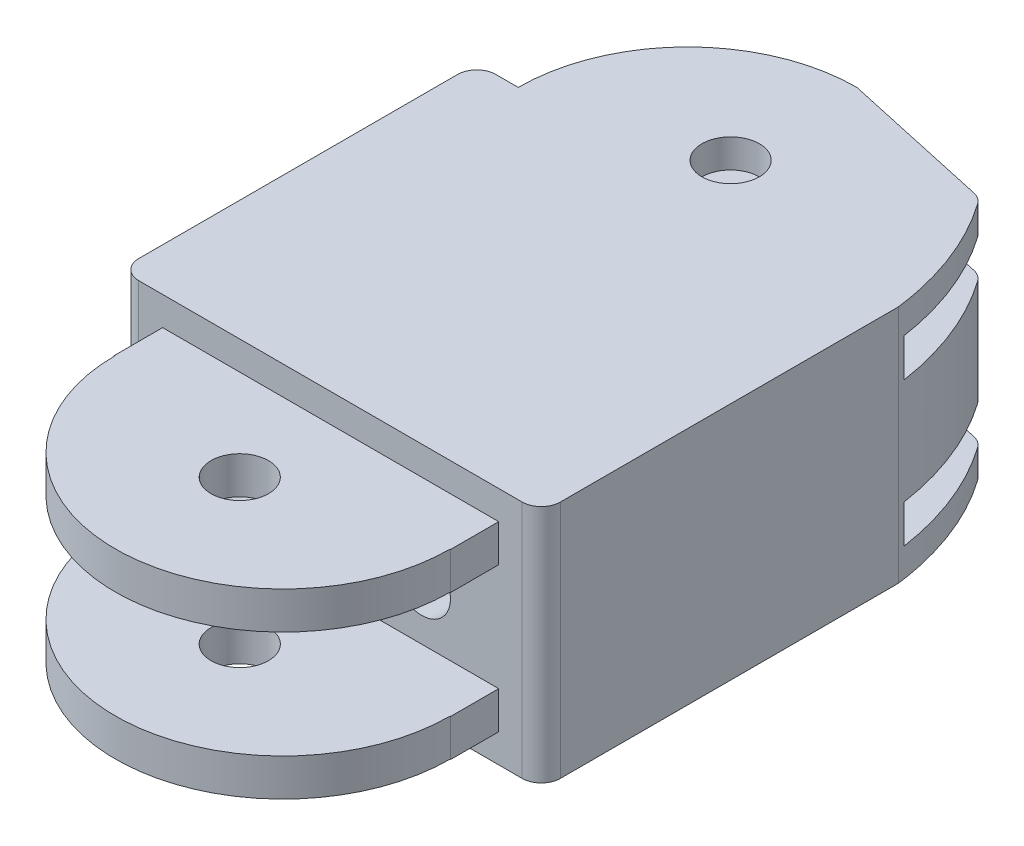
from build123d import *

# Parameters (mm, degrees)
SKETCH2_W             = 17.554431489
SKETCH2_H             = 1.95
BOSS_EXTRUDE1_DEPTH   = 8.75
BOSS_EXTRUDE1_2_DEPTH = 8.75
CUT_EXTRUDE1_DEPTH    = 26.518349076
SKETCH4_W             = 22.027215745
SKETCH4_H             = 12.505427167
BOSS_EXTRUDE2_DEPTH   = 30
SKETCH5_R             = 1.5
CUT_EXTRUDE2_DEPTH    = 12
SKETCH6_W             = 22.027215745
SKETCH6_H             = 12.505427167
SKETCH6_W_2           = 17.554431489
SKETCH6_H_2           = 1.95
CUT_EXTRUDE3_DEPTH    = 2.5
SKETCH7_R             = 1.5
CUT_EXTRUDE4_DEPTH    = 13
SKETCH8_R             = 1.5
CUT_EXTRUDE5_DEPTH    = 28
FILLET3_R             = 1
SKETCH9_W             = 22.02721574
SKETCH9_H             = 2
CUT_EXTRUDE6_DEPTH    = 11


with BuildPart() as part:
    # Sketch2 → Boss-Extrude1 (new body)
    with BuildSketch(Plane.XY):
        with Locations((-13.228930986, -27.845183414)):
            Rectangle(SKETCH2_W, SKETCH2_H)
    extrude(amount=BOSS_EXTRUDE1_DEPTH)


with BuildPart() as body_2:
    # Sketch2 → Boss-Extrude1 2 (new body)
    with BuildSketch(Plane.XY):
        with Locations((-13.228930986, -20.289756247)):
            Rectangle(SKETCH2_W, SKETCH2_H)
    extrude(amount=BOSS_EXTRUDE1_2_DEPTH)


with BuildPart() as cut_extrude1_tool:
    # Sketch3 → Cut-Extrude1 (new, through all)
    with BuildSketch(Plane(origin=(0, -19.314756247, 0), x_dir=(1, 0, 0), z_dir=(0, 1, 0))):
        with BuildLine():
            ThreePointArc((-13.228930986, -8.75), (-7.041746651, -6.187184335), (-4.478930986, 0))
            add(Edge.make_bspline(
                [(-4.478930986, 0), (1.138349918, -4.151657709), (-4.451715242, -8.75)],
                knots=[0, 0, 0, 1, 1, 1], degree=2))
            add(Edge.make_bspline(
                [(-22.006146731, -8.75), (-13.228930986, -12.473510392), (-4.451715242, -8.75)],
                knots=[0, 0, 0, 1, 1, 1], degree=2))
            add(Edge.make_bspline(
                [(-21.978930986, 0), (-25.926969228, -4.242865138), (-22.006146731, -8.75)],
                knots=[0, 0, 0, 1, 1, 1], degree=2))
            ThreePointArc((-21.978930986, 0), (-19.416115322, -6.187184335), (-13.228930986, -8.75))
        make_face()
    extrude(amount=-CUT_EXTRUDE1_DEPTH)


with BuildPart() as part_1:
    add(part.part)

    # Cut-Extrude1: cut by cut_extrude1_tool
    add(cut_extrude1_tool.part, mode=Mode.SUBTRACT)



with BuildPart() as body_2_1:
    add(body_2.part)

    # Cut-Extrude1: cut by cut_extrude1_tool
    add(cut_extrude1_tool.part, mode=Mode.SUBTRACT)


with BuildPart() as part_2:
    add(part_1.part)

    add(body_2_1.part)  # Boss-Extrude2 merges body 2
    # Sketch4 → Boss-Extrude2 (add)
    with BuildSketch(Plane(origin=(0, 0, 0), x_dir=(-1, 0, 0), z_dir=(0, 0, -1))):
        with Locations((13.242538859, -24.067469831)):
            Rectangle(SKETCH4_W, SKETCH4_H)
    extrude(amount=BOSS_EXTRUDE2_DEPTH)

    # Sketch5 → Cut-Extrude2 (cut)
    with BuildSketch(Plane(origin=(0, -19.314756247, 0), x_dir=(1, 0, 0), z_dir=(0, 1, 0))):
        with Locations(Location((-13.228930986, -2.25, 0), (0, 0, 270))):
            Circle(SKETCH5_R)
    extrude(amount=-CUT_EXTRUDE2_DEPTH, mode=Mode.SUBTRACT)

    # Sketch6 → Cut-Extrude3 (cut)
    with BuildSketch(Plane.XY):
        with Locations((-13.242538859, -24.067469831)):
            Rectangle(SKETCH6_W, SKETCH6_H)
        with Locations((-13.228930986, -27.845183414)):
            Rectangle(SKETCH6_W_2, SKETCH6_H_2, mode=Mode.SUBTRACT)
        with Locations((-13.228930986, -20.289756247)):
            Rectangle(SKETCH6_W_2, SKETCH6_H_2, mode=Mode.SUBTRACT)
    extrude(amount=-CUT_EXTRUDE3_DEPTH, mode=Mode.SUBTRACT)

    # Sketch7 → Cut-Extrude4 (cut)
    with BuildSketch(Plane(origin=(0, -17.814756247, 0), x_dir=(1, 0, 0), z_dir=(0, 1, 0))):
        with Locations(Location((-13.242538859, 23.405672985, 0), (0, 0, 270))):
            Circle(SKETCH7_R)
        with BuildLine():
            Line((-22.086865874, 21.155672985), (-24.256146731, 21.155672985))
            add(Edge.make_bspline(
                [(-2.228930986, 21.155672985), (11.471530889, 27.189710441), (-11.765166974, 53.431279988), (-37.007876173, 21.523583672), (-24.256146731, 21.155672985)],
                knots=[0, 0, 0, 0, 0.52011282, 1, 1, 1, 1], degree=3))
            add(Edge.make_bspline(
                [(-5.046294073, 28.201654423), (-2.731488374, 25.068620188), (-2.228930986, 21.155672985)],
                knots=[0, 0, 0, 1, 1, 1], degree=2))
            Line((-5.046294073, 28.201654423), (-13.242538859, 30))
            ThreePointArc((-13.242538859, 30), (-19.496422466, 27.409556592), (-22.086865874, 21.155672985))
        make_face()
    extrude(amount=-CUT_EXTRUDE4_DEPTH, mode=Mode.SUBTRACT)

    # Sketch8 → Cut-Extrude5 (cut)
    with BuildSketch(Plane.XY.offset(-2.5)):
        with Locations((-18.011106811, -24.06746983)):
            Circle(SKETCH8_R)
        with Locations((-8.473970906, -24.06746983)):
            Circle(SKETCH8_R)
    extrude(amount=-CUT_EXTRUDE5_DEPTH, mode=Mode.SUBTRACT)

    # Fillet3
    fillet3_edges = [part_2.edges().sort_by_distance(p)[0] for p in [
        (-24.256146731, -24.06746983, -2.5),
        (-24.256146731, -24.06746983, -21.155672985),
        (-2.228930986, -24.06746983, -2.5),
        (-5.046294073, -24.06746983, -28.201654423),
    ]]
    fillet(fillet3_edges, radius=FILLET3_R)

    # Sketch9 → Cut-Extrude6 (cut)
    with BuildSketch(Plane.XY.offset(-32.5)):
        with Locations((-13.24253886, -20.31475625)):
            Rectangle(SKETCH9_W, SKETCH9_H)
        with Locations((-13.24253886, -27.836055834)):
            Rectangle(SKETCH9_W, SKETCH9_H)
    extrude(amount=CUT_EXTRUDE6_DEPTH, mode=Mode.SUBTRACT)


solid = part_2.part
